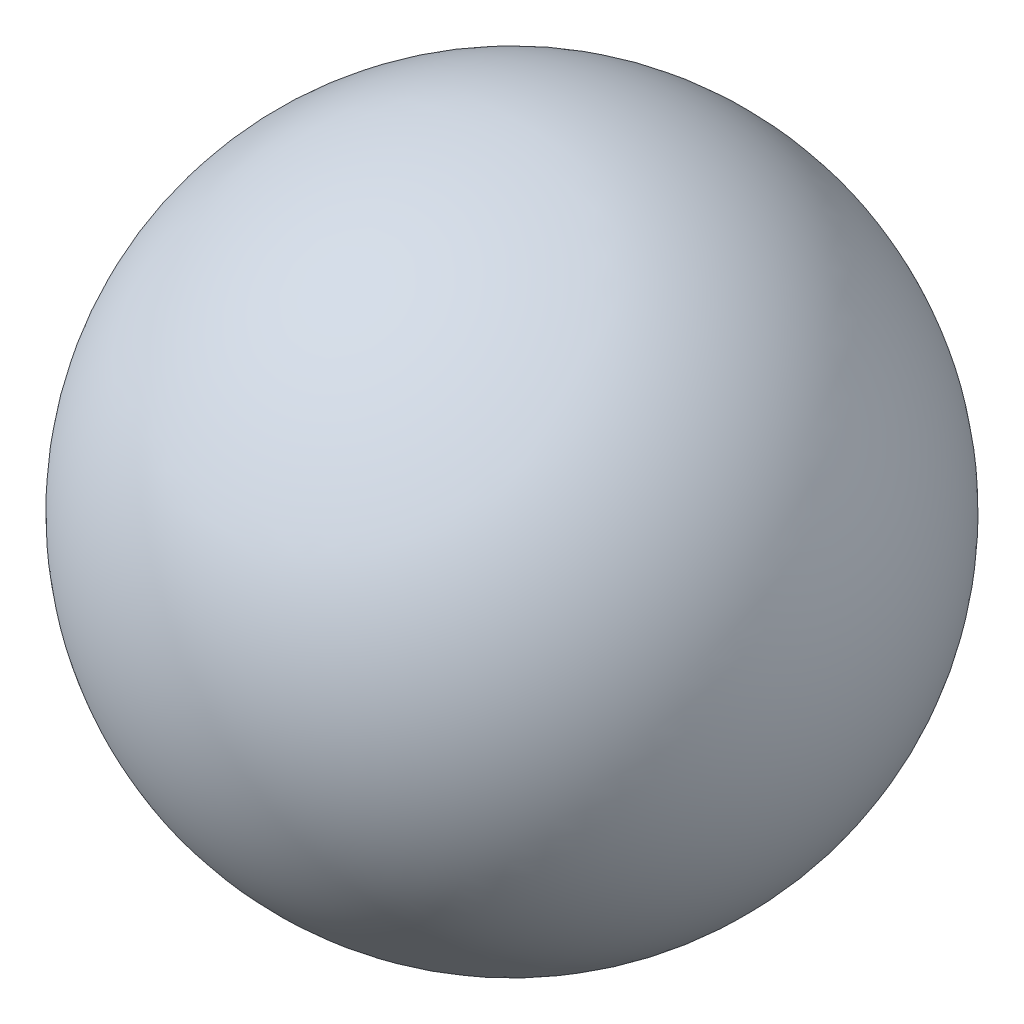
from build123d import *


with BuildPart() as part:
    # Sketch1 → Revolve1 (revolve)
    with BuildSketch(Plane(origin=(0, 0, 0), x_dir=(1, 0, 0), z_dir=(0, 1, 0))):
        with BuildLine():
            Line((0, 350), (0, -350))
            ThreePointArc((0, -350), (350, 0), (0, 350))
        make_face()
    revolve(axis=Axis((0, 0, -350), (0, 0, 1)))


solid = part.part
